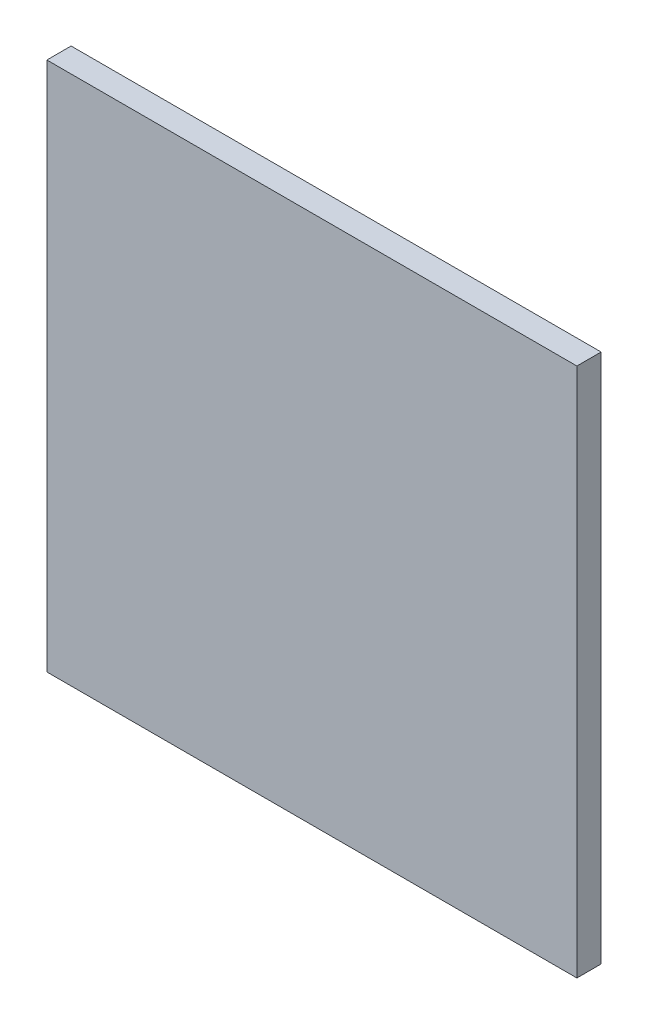
from build123d import *

# Parameters (mm, degrees)
ESBO_O1_W                = 490
ESBO_O1_H                = 490
RESSALTO_EXTRUS_O1_DEPTH = 22.4


with BuildPart() as part:
    # Esboço1 → Ressalto-extrusão1 (new body)
    with BuildSketch(Plane.XY):
        Rectangle(ESBO_O1_W, ESBO_O1_H)
    extrude(amount=RESSALTO_EXTRUS_O1_DEPTH)


solid = part.part
